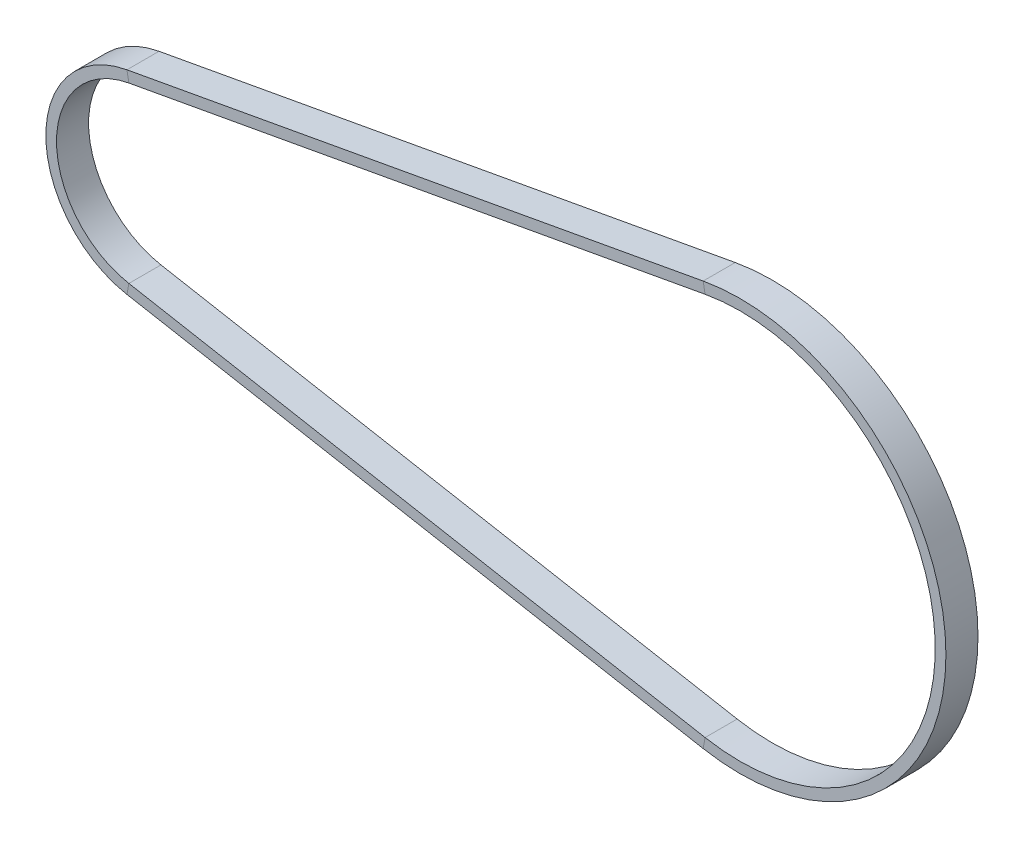
from build123d import *

# Parameters (mm, degrees)
ESBO_O2_W = 6
ESBO_O2_H = 2


with BuildPart() as part:
    # Varredura1: sweep along a path in Esboço1
    with BuildLine(Plane.XY) as varredura1_path:
        Line((-60.462858141, 17.215577733), (47.330289745, 36.890523713))
        ThreePointArc((47.330289745, 36.890523713), (91.563733155, 0), (47.330289745, -36.890523713))
        Line((47.330289745, -36.890523713), (-60.462858141, -17.215577733))
        ThreePointArc((-60.462858141, -17.215577733), (-74.82058455, 0), (-60.462858141, 17.215577733))
    # Esboço2 → Varredura1 (sweep)
    with BuildSketch(Plane(origin=(-60.462858141, 17.215577733, 0), x_dir=(0, 0, -1), z_dir=(0.9837472990234445, 0.17955849092726803, 0))):
        Rectangle(ESBO_O2_W, ESBO_O2_H)
    sweep(path=varredura1_path.line)


solid = part.part
